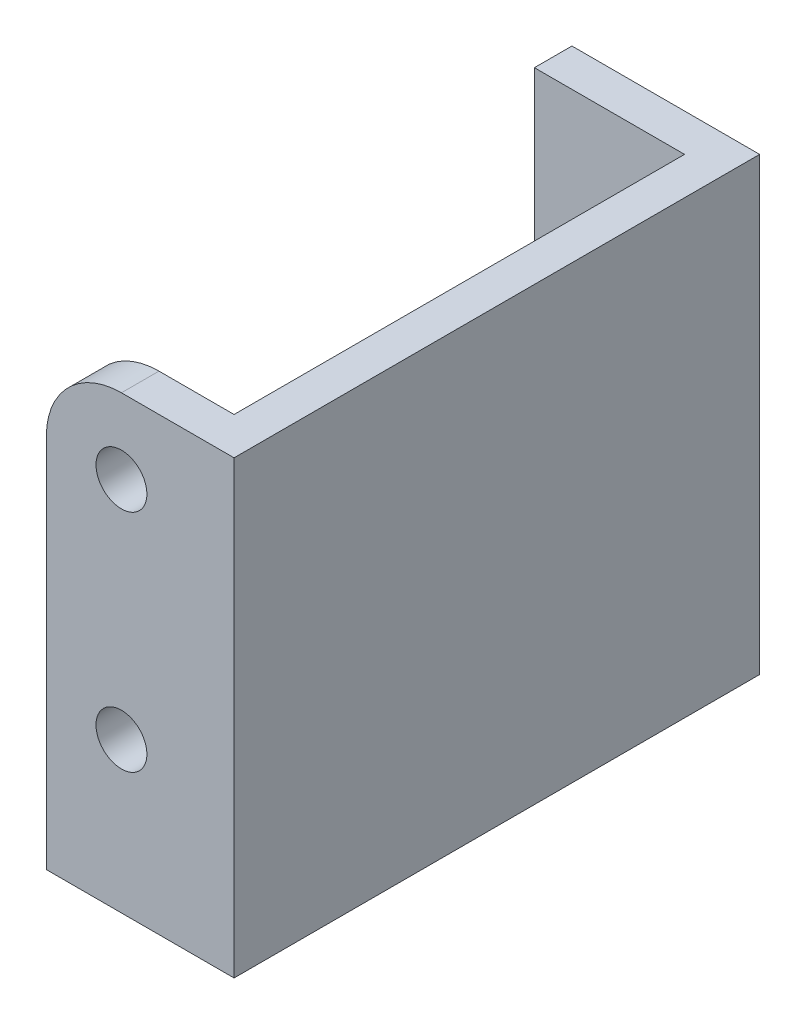
from build123d import *

# Parameters (mm, degrees)
SKETCH1_W           = 15.875
SKETCH1_H           = 38.1
BOSS_EXTRUDE1_DEPTH = 44.45
SHELL1_T            = -3.175
CUT_EXTRUDE1_REACH  = 51.007
SKETCH2_R           = 2.15265
FILLET2_R           = 6.35


with BuildPart() as part:
    # Sketch1 → Boss-Extrude1 (new body)
    with BuildSketch(Plane.XY):
        Rectangle(SKETCH1_W, SKETCH1_H)
    extrude(amount=-BOSS_EXTRUDE1_DEPTH)

    # Shell1
    shell1_openings = [part.faces().sort_by_distance(p)[0] for p in [
        (-7.9375, 0, -22.225),
        (0, 19.05, -22.225),
    ]]
    offset(amount=SHELL1_T, openings=shell1_openings, kind=Kind.INTERSECTION)

    # Sketch2 → Cut-Extrude1 (cut, up to next)
    with BuildSketch(Plane.XY, mode=Mode.PRIVATE) as cut_extrude1_sk1:
        with Locations((-1.5875, -6.35)):
            Circle(SKETCH2_R)
    cut_extrude1_tool1 = extrude(cut_extrude1_sk1.sketch, amount=-CUT_EXTRUDE1_REACH, mode=Mode.PRIVATE) & part.part
    # Sketch2 → Cut-Extrude1 (cut, up to next)
    with BuildSketch(Plane.XY, mode=Mode.PRIVATE) as cut_extrude1_sk2:
        with Locations((-1.5875, 12.7)):
            Circle(SKETCH2_R)
    cut_extrude1_tool2 = extrude(cut_extrude1_sk2.sketch, amount=-CUT_EXTRUDE1_REACH, mode=Mode.PRIVATE) & part.part
    add(cut_extrude1_tool1.solids().sort_by_distance((-1.5875, -6.35, 0))[0], mode=Mode.SUBTRACT)
    add(cut_extrude1_tool2.solids().sort_by_distance((-1.5875, 12.7, 0))[0], mode=Mode.SUBTRACT)

    # Fillet2
    fillet2_edges = [part.edges().sort_by_distance(p)[0] for p in [
        (-7.9375, 19.05, -1.5875),
    ]]
    fillet(fillet2_edges, radius=FILLET2_R)


solid = part.part
